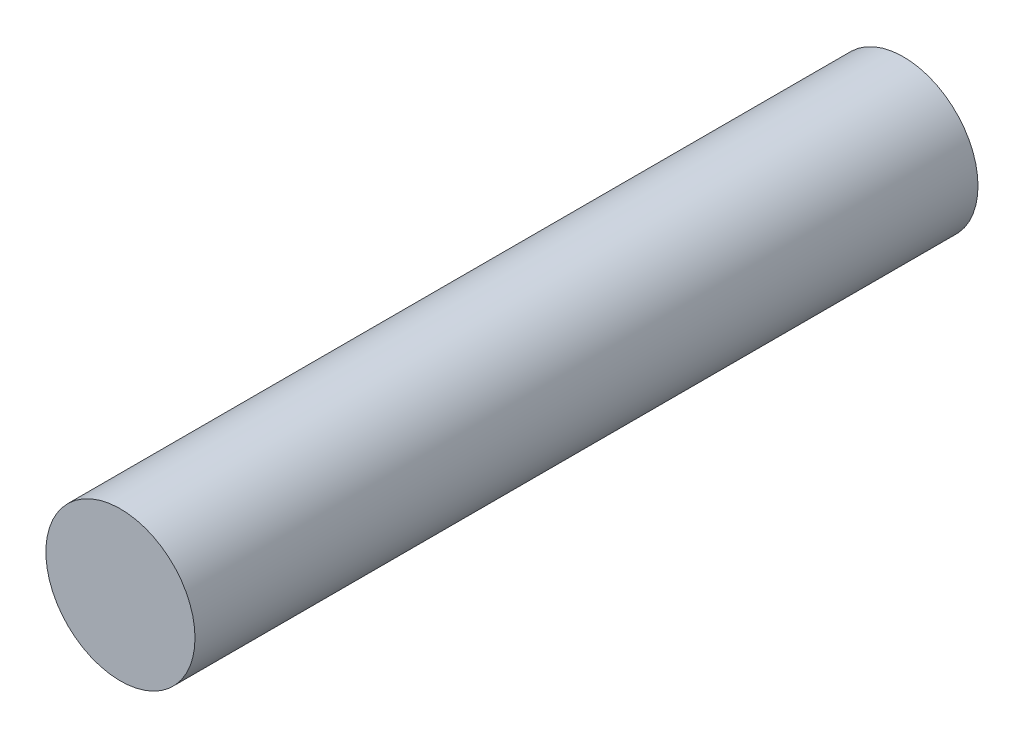
from build123d import *

# Parameters (mm, degrees)
SKETCH1_R           = 2.125
BOSS_EXTRUDE1_DEPTH = 21
CUT_EXTRUDE1_START  = -28
SKETCH3_R           = 2.125
SKETCH3_R_2         = 2
CUT_EXTRUDE1_DEPTH  = 28


with BuildPart() as part:
    # Sketch1 → Boss-Extrude1 (new body)
    with BuildSketch(Plane.XY):
        with Locations(Location((0, 0, 0), (0, 0, 180))):
            Circle(SKETCH1_R)
    extrude(amount=BOSS_EXTRUDE1_DEPTH)

    # Sketch3 → Cut-Extrude1 (cut)
    with BuildSketch(Plane.XY.offset(21).offset(CUT_EXTRUDE1_START)):
        Circle(SKETCH3_R)
        Circle(SKETCH3_R_2, mode=Mode.SUBTRACT)
    extrude(amount=CUT_EXTRUDE1_DEPTH, mode=Mode.SUBTRACT)


solid = part.part
